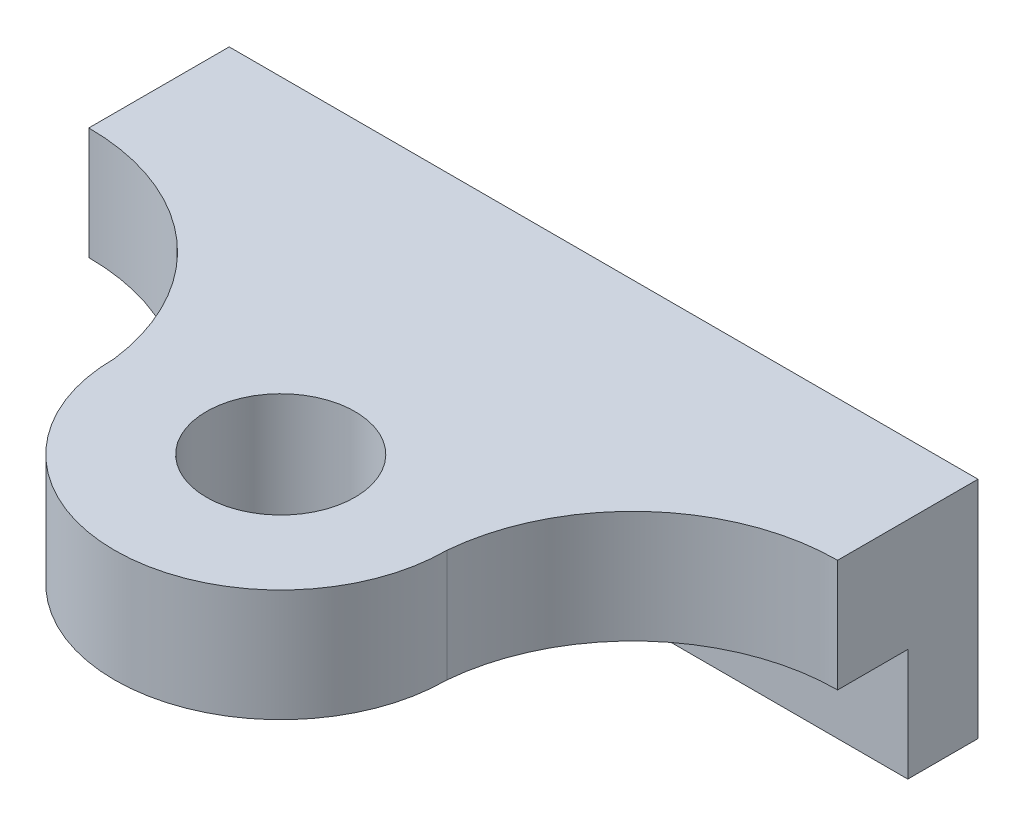
from build123d import *

# Parameters (mm, degrees)
SKETCH1_R           = 17.75
SKETCH1_R_2         = 7.94
BOSS_EXTRUDE1_DEPTH = 12
BOSS_EXTRUDE6_DEPTH = 12
SKETCH9_W           = 80
SKETCH9_H           = 15
BOSS_EXTRUDE7_DEPTH = 12
SKETCH10_W          = 80
SKETCH10_H          = 7.5
BOSS_EXTRUDE8_DEPTH = 12


with BuildPart() as part:
    # Sketch1 → Boss-Extrude1 (new body)
    with BuildSketch(Plane(origin=(0, 0, 0), x_dir=(1, 0, 0), z_dir=(0, 1, 0))):
        with Locations(Location((0, 0, 0), (0, 0, 270))):
            Circle(SKETCH1_R)
        with Locations(Location((0, 0, 0), (0, 0, 270))):
            Circle(SKETCH1_R_2, mode=Mode.SUBTRACT)
    extrude(amount=BOSS_EXTRUDE1_DEPTH)

    # Sketch6 → Boss-Extrude6 (add)
    with BuildSketch(Plane.XZ):
        with BuildLine():
            Line((-0.456324954, -19.952681815), (-40.456324954, -19.952681815))
            ThreePointArc((-40.456324954, -19.952681815), (-25.342699441, -14.255780456), (-17.75, 0))
            ThreePointArc((-17.75, 0), (0, -17.75), (17.75, 0))
            ThreePointArc((17.75, 0), (24.769764057, -14.21114403), (39.543675046, -19.952681815))
            Line((39.543675046, -19.952681815), (-0.456324954, -19.952681815))
        make_face()
    extrude(amount=-BOSS_EXTRUDE6_DEPTH)

    # Sketch9 → Boss-Extrude7 (add)
    with BuildSketch(Plane(origin=(0, 0, 0), x_dir=(-1, 0, 0), z_dir=(0, -1, 0))):
        with Locations((0.456324954, 27.452681815)):
            Rectangle(SKETCH9_W, SKETCH9_H)
    extrude(amount=-BOSS_EXTRUDE7_DEPTH)

    # Sketch10 → Boss-Extrude8 (add)
    with BuildSketch(Plane.XZ):
        with Locations((-0.456324954, -31.202681815)):
            Rectangle(SKETCH10_W, SKETCH10_H)
    extrude(amount=BOSS_EXTRUDE8_DEPTH)


solid = part.part
